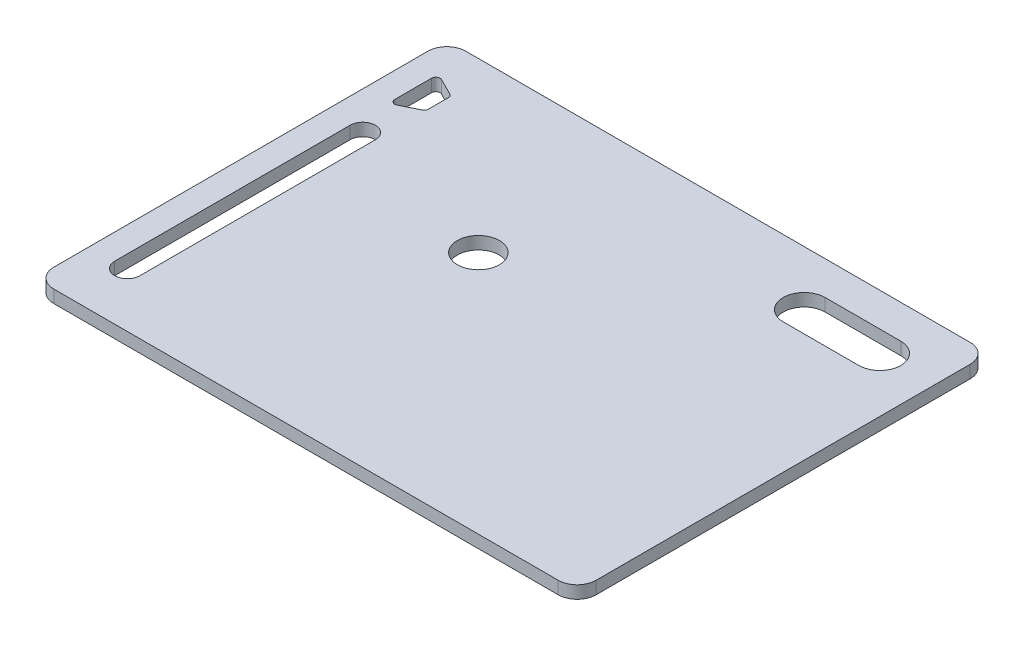
from build123d import *

# Parameters (mm, degrees)
SKETCH1_W           = 819.15
SKETCH1_H           = 622.3
BOSS_EXTRUDE1_DEPTH = 19.05
FILLET1_R           = 28.575
SKETCH2_R           = 31.75
CUT_EXTRUDE1_DEPTH  = 515.712449456
CUT_EXTRUDE2_DEPTH  = 515.712449456
CUT_EXTRUDE3_DEPTH  = 515.712449456
FILLET2_R           = 6.35
CUT_EXTRUDE4_DEPTH  = 515.712449456


with BuildPart() as part:
    # Sketch1 → Boss-Extrude1 (new body)
    with BuildSketch(Plane(origin=(0, 0, 0), x_dir=(1, 0, 0), z_dir=(0, 1, 0))):
        Rectangle(SKETCH1_W, SKETCH1_H)
    extrude(amount=BOSS_EXTRUDE1_DEPTH)

    # Fillet1
    fillet1_edges = [part.edges().sort_by_distance(p)[0] for p in [
        (409.575, 9.525, 311.15),
        (-409.575, 9.525, 311.15),
        (-409.575, 9.525, -311.15),
        (409.575, 9.525, -311.15),
    ]]
    fillet(fillet1_edges, radius=FILLET1_R)

    # Sketch2 → Cut-Extrude1 (cut, through all)
    with BuildSketch(Plane(origin=(0, 19.05, 0), x_dir=(1, 0, 0), z_dir=(0, 1, 0))):
        with Locations(Location((-107.95, 57.15, 0), (0, 0, 270))):
            Circle(SKETCH2_R)
    extrude(amount=-CUT_EXTRUDE1_DEPTH, mode=Mode.SUBTRACT)

    # Sketch3 → Cut-Extrude2 (cut, through all)
    with BuildSketch(Plane(origin=(0, 19.05, 0), x_dir=(1, 0, 0), z_dir=(0, 1, 0))):
        with BuildLine():
            Line((-333.375, 127), (-333.375, -228.6))
            ThreePointArc((-333.375, -228.6), (-352.425, -247.65), (-371.475, -228.6))
            Line((-371.475, -228.6), (-371.475, 127))
            ThreePointArc((-371.475, 127), (-352.425, 146.05), (-333.375, 127))
        make_face()
    extrude(amount=-CUT_EXTRUDE2_DEPTH, mode=Mode.SUBTRACT)

    # Sketch4 → Cut-Extrude3 (cut, through all)
    with BuildSketch(Plane(origin=(0, 19.05, 0), x_dir=(1, 0, 0), z_dir=(0, 1, 0))):
        Polygon((-371.475, 260.35), (-371.475, 184.15), (-333.375, 203.2), (-333.375, 241.3), align=None)
    extrude(amount=-CUT_EXTRUDE3_DEPTH, mode=Mode.SUBTRACT)

    # Fillet2
    fillet2_edges = [part.edges().sort_by_distance(p)[0] for p in [
        (-371.475, 9.525, -260.35),
        (-333.375, 9.525, -241.3),
        (-333.375, 9.525, -203.2),
        (-371.475, 9.525, -184.15),
    ]]
    fillet(fillet2_edges, radius=FILLET2_R)

    # Sketch5 → Cut-Extrude4 (cut, through all)
    with BuildSketch(Plane(origin=(0, 19.05, 0), x_dir=(1, 0, 0), z_dir=(0, 1, 0))):
        with BuildLine():
            Line((327.025, 196.85), (212.725, 196.85))
            ThreePointArc((212.725, 196.85), (180.975, 228.6), (212.725, 260.35))
            Line((212.725, 260.35), (327.025, 260.35))
            ThreePointArc((327.025, 260.35), (358.775, 228.6), (327.025, 196.85))
        make_face()
    extrude(amount=-CUT_EXTRUDE4_DEPTH, mode=Mode.SUBTRACT)


solid = part.part
